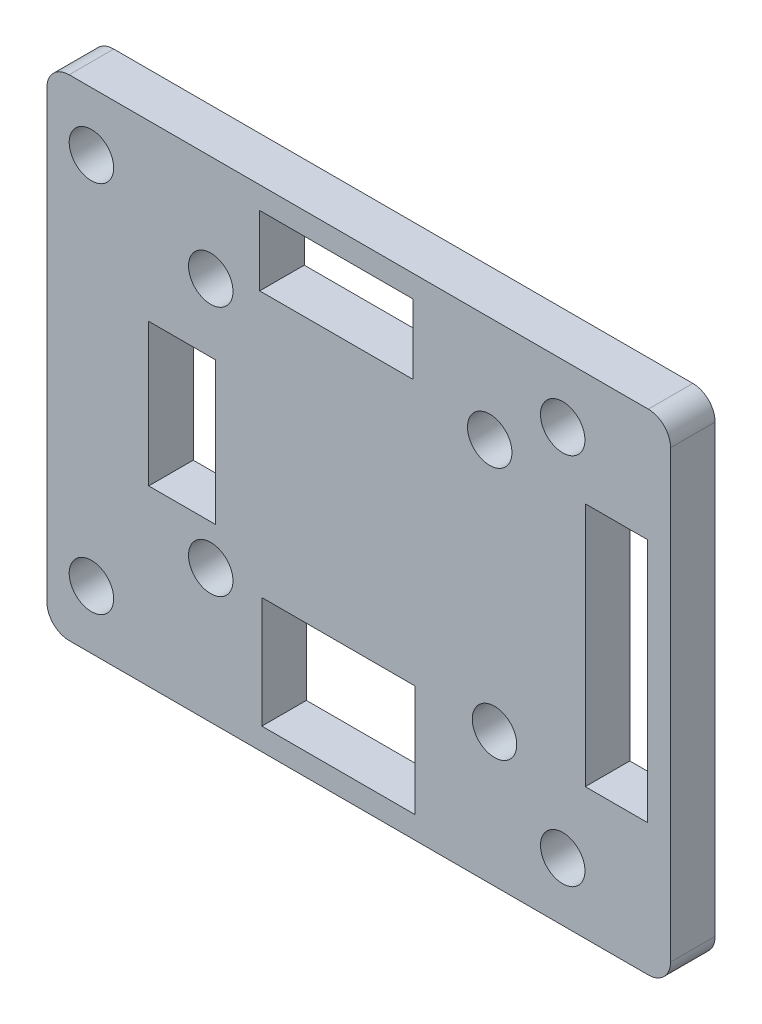
from build123d import *

# Parameters (mm, degrees)
SKETCH1_W           = 35.56
SKETCH1_H           = 27.94
SKETCH1_R           = 1.267511842
SKETCH1_W_2         = 3.556
SKETCH1_H_2         = 13.97
SKETCH1_W_3         = 8.73125
SKETCH1_H_3         = 3.96875
SKETCH1_W_4         = 3.81
SKETCH1_H_4         = 8.128
SKETCH1_W_5         = 8.7379065
SKETCH1_H_5         = 6.35
BOSS_EXTRUDE1_DEPTH = 2.54
FILLET1_R           = 1.27


with BuildPart() as part:
    # Sketch1 → Boss-Extrude1 (new body)
    with BuildSketch(Plane.XY):
        with Locations((17.78, 13.97)):
            Rectangle(SKETCH1_W, SKETCH1_H)
        with Locations((2.54, 24.608738158)):
            Circle(SKETCH1_R, mode=Mode.SUBTRACT)
        with Locations(Location((25.24883074, 21.9075, 0), (0, 0, 180))):
            Circle(SKETCH1_R, mode=Mode.SUBTRACT)
        with Locations((9.34208074, 21.9075)):
            Circle(SKETCH1_R, mode=Mode.SUBTRACT)
        with Locations(Location((29.410568897, 24.608738158, 0), (0, 0, 180))):
            Circle(SKETCH1_R, mode=Mode.SUBTRACT)
        with Locations((25.52228569, 7.62)):
            Circle(SKETCH1_R, mode=Mode.SUBTRACT)
        with Locations((9.34208074, 7.62)):
            Circle(SKETCH1_R, mode=Mode.SUBTRACT)
        with Locations((2.54, 3.331261842)):
            Circle(SKETCH1_R, mode=Mode.SUBTRACT)
        with Locations((29.410568897, 3.331261842)):
            Circle(SKETCH1_R, mode=Mode.SUBTRACT)
        with Locations((32.47553569, 14.486722307)):
            Rectangle(SKETCH1_W_2, SKETCH1_H_2, mode=Mode.SUBTRACT)
        with Locations((16.50170574, 24.685625)):
            Rectangle(SKETCH1_W_3, SKETCH1_H_3, mode=Mode.SUBTRACT)
        with Locations((7.7109414, 13.97)):
            Rectangle(SKETCH1_W_4, SKETCH1_H_4, mode=Mode.SUBTRACT)
        with Locations((16.62537749, 4.445)):
            Rectangle(SKETCH1_W_5, SKETCH1_H_5, mode=Mode.SUBTRACT)
    extrude(amount=BOSS_EXTRUDE1_DEPTH)

    # Fillet1
    fillet1_edges = [part.edges().sort_by_distance(p)[0] for p in [
        (0, 27.94, 1.27),
        (35.56, 27.94, 1.27),
        (35.56, 0, 1.27),
        (0, 0, 1.27),
    ]]
    fillet(fillet1_edges, radius=FILLET1_R)


solid = part.part
